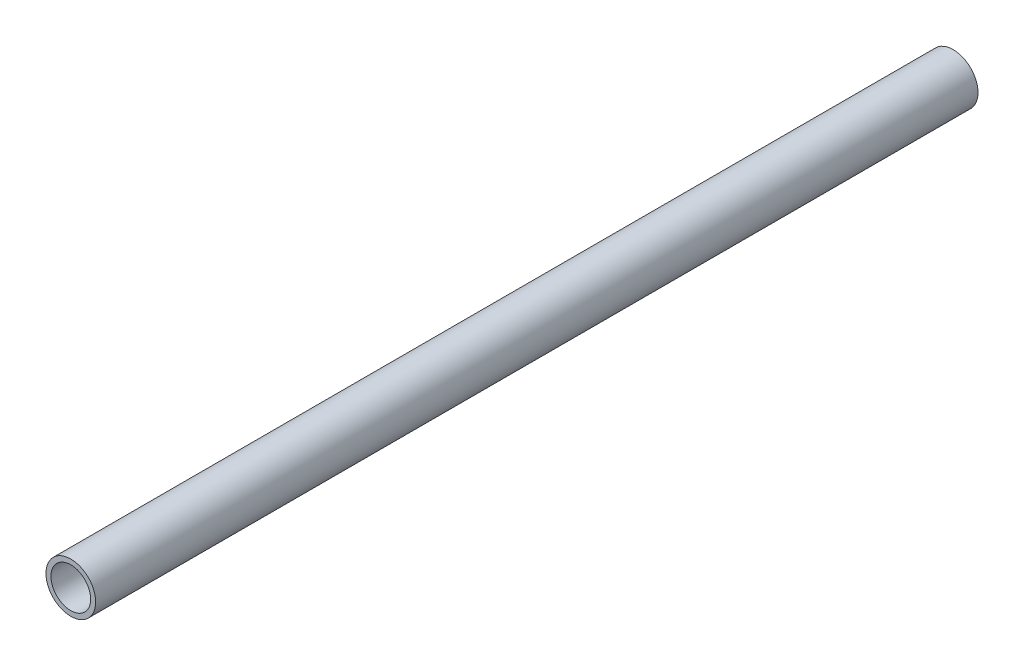
from build123d import *

# Parameters (mm, degrees)
SKETCH1_R           = 5
SKETCH1_R_2         = 4
BOSS_EXTRUDE1_DEPTH = 177.65014


with BuildPart() as part:
    # Sketch1 → Boss-Extrude1 (new body)
    with BuildSketch(Plane.XY):
        Circle(SKETCH1_R)
        Circle(SKETCH1_R_2, mode=Mode.SUBTRACT)
    extrude(amount=BOSS_EXTRUDE1_DEPTH)


solid = part.part
